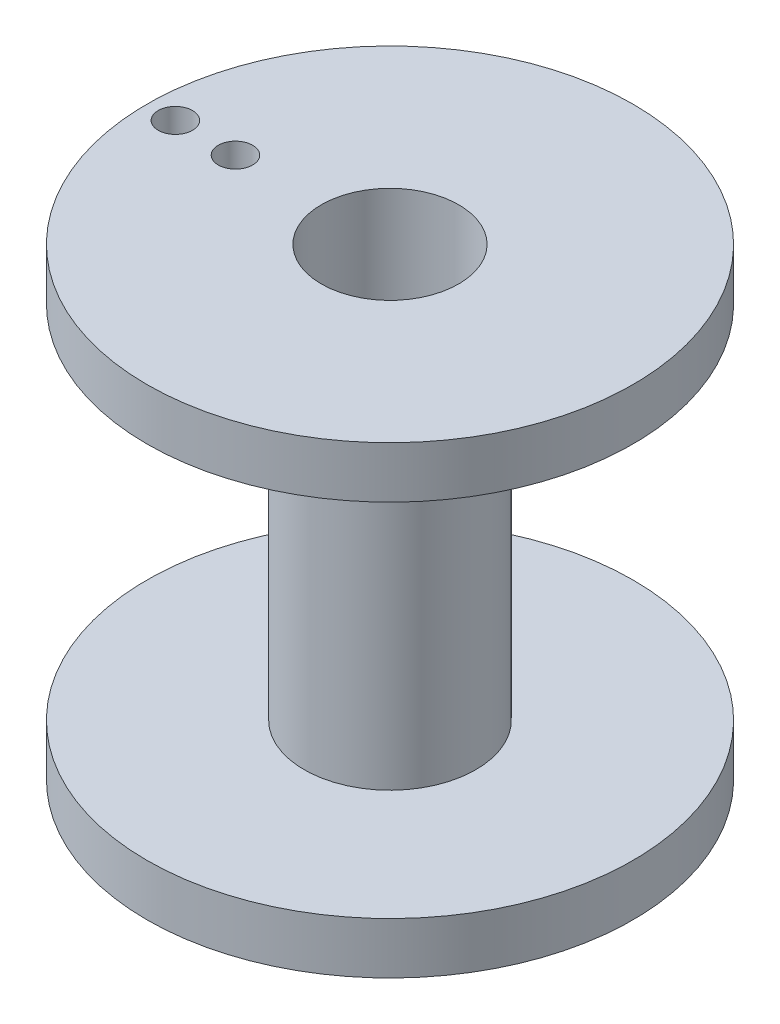
from build123d import *

# Parameters (mm, degrees)
SKETCH1_R           = 14.15
BOSS_EXTRUDE1_DEPTH = 3
SKETCH2_R           = 5
BOSS_EXTRUDE2_DEPTH = 21
SKETCH3_R           = 14.15
BOSS_EXTRUDE3_DEPTH = 3
SKETCH4_R           = 4
CUT_EXTRUDE1_DEPTH  = 34.607216487
CUT_EXTRUDE2_REACH  = 35.607
SKETCH5_R           = 1


with BuildPart() as part:
    # Sketch1 → Boss-Extrude1 (new body)
    with BuildSketch(Plane(origin=(0, 0, 0), x_dir=(1, 0, 0), z_dir=(0, 1, 0))):
        with Locations(Location((0, 0, 0), (0, 0, 270))):
            Circle(SKETCH1_R)
    extrude(amount=BOSS_EXTRUDE1_DEPTH)

    # Sketch2 → Boss-Extrude2 (add)
    with BuildSketch(Plane(origin=(0, 3, 0), x_dir=(1, 0, 0), z_dir=(0, 1, 0))):
        with Locations(Location((0, 0, 0), (0, 0, 90))):
            Circle(SKETCH2_R)
    extrude(amount=BOSS_EXTRUDE2_DEPTH)

    # Sketch3 → Boss-Extrude3 (add)
    with BuildSketch(Plane(origin=(0, 24, 0), x_dir=(1, 0, 0), z_dir=(0, 1, 0))):
        with Locations(Location((0, 0, 0), (0, 0, 270))):
            Circle(SKETCH3_R)
    extrude(amount=BOSS_EXTRUDE3_DEPTH)

    # Sketch4 → Cut-Extrude1 (cut, through all)
    with BuildSketch(Plane(origin=(0, 27, 0), x_dir=(1, 0, 0), z_dir=(0, 1, 0))):
        with Locations(Location((0, 0, 0), (0, 0, 270))):
            Circle(SKETCH4_R)
    extrude(amount=-CUT_EXTRUDE1_DEPTH, mode=Mode.SUBTRACT)

    # Sketch5 → Cut-Extrude2 (cut, up to next)
    with BuildSketch(Plane(origin=(0, 27, 0), x_dir=(1, 0, 0), z_dir=(0, 1, 0)), mode=Mode.PRIVATE) as cut_extrude2_sk1:
        with Locations(Location((-9, 0, 0), (0, 0, 270))):
            Circle(SKETCH5_R)
    cut_extrude2_tool1 = extrude(cut_extrude2_sk1.sketch, amount=-CUT_EXTRUDE2_REACH, mode=Mode.PRIVATE) & part.part
    # Sketch5 → Cut-Extrude2 (cut, up to next)
    with BuildSketch(Plane(origin=(0, 27, 0), x_dir=(1, 0, 0), z_dir=(0, 1, 0)), mode=Mode.PRIVATE) as cut_extrude2_sk2:
        with Locations(Location((-12.5, 0, 0), (0, 0, 270))):
            Circle(SKETCH5_R)
    cut_extrude2_tool2 = extrude(cut_extrude2_sk2.sketch, amount=-CUT_EXTRUDE2_REACH, mode=Mode.PRIVATE) & part.part
    add(cut_extrude2_tool1.solids().sort_by_distance((-9, 27, 0))[0], mode=Mode.SUBTRACT)
    add(cut_extrude2_tool2.solids().sort_by_distance((-12.5, 27, 0))[0], mode=Mode.SUBTRACT)


solid = part.part
